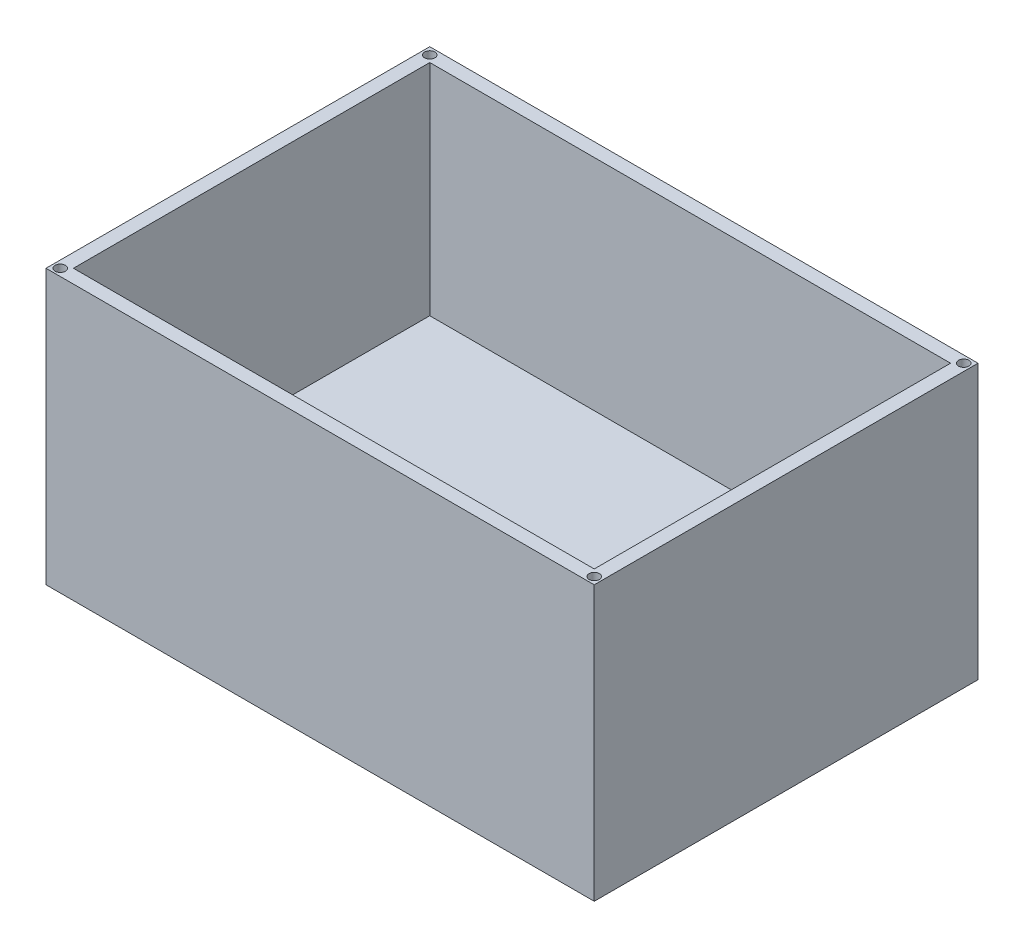
from build123d import *

# Parameters (mm, degrees)
SKETCH1_W                            = 254
SKETCH1_H                            = 177.8
BOSS_EXTRUDE1_DEPTH                  = 127
SKETCH2_W                            = 241.3
SKETCH2_H                            = 165.1
CUT_EXTRUDE1_DEPTH                   = 101.6
F_3_16_0_1875_DIAMETER_HOLE3_D       = 4.7625
F_3_16_0_1875_DIAMETER_HOLE3_DEPTH   = 12.7
F_3_16_0_1875_DIAMETER_HOLE3_TIP     = 1.430799349
F_3_16_0_1875_DIAMETER_HOLE4_D       = 4.7625
F_3_16_0_1875_DIAMETER_HOLE4_DEPTH   = 12.7
F_3_16_0_1875_DIAMETER_HOLE4_TIP     = 1.430799349
F_3_16_0_1875_DIAMETER_HOLE5_D       = 4.7625
F_3_16_0_1875_DIAMETER_HOLE5_DEPTH   = 12.7
F_3_16_0_1875_DIAMETER_HOLE5_TIP     = 1.430799349
F_3_16_0_1875_DIAMETER_HOLE6_D       = 4.7625
F_3_16_0_1875_DIAMETER_HOLE6_DEPTH   = 12.7
F_3_16_0_1875_DIAMETER_HOLE6_TIP     = 1.430799349
F_11_64_0_17188_DIAMETER_HOLE1_D     = 4.365752
F_11_64_0_17188_DIAMETER_HOLE1_DEPTH = 6.35


with BuildPart() as part:
    # Sketch1 → Boss-Extrude1 (new body)
    with BuildSketch(Plane(origin=(0, 0, 0), x_dir=(1, 0, 0), z_dir=(0, 1, 0))):
        Rectangle(SKETCH1_W, SKETCH1_H)
    extrude(amount=BOSS_EXTRUDE1_DEPTH)

    # Sketch2 → Cut-Extrude1 (cut)
    with BuildSketch(Plane(origin=(0, 127, 0), x_dir=(1, 0, 0), z_dir=(0, 1, 0))):
        Rectangle(SKETCH2_W, SKETCH2_H)
    extrude(amount=-CUT_EXTRUDE1_DEPTH, mode=Mode.SUBTRACT)

    # 3/16 (0.1875) Diameter Hole3
    with Locations(Plane(origin=(-123.698, 127, -85.598), x_dir=(0, 0, 1), z_dir=(0, 1, 0))):
        with Locations((0, 0)):
            Hole(F_3_16_0_1875_DIAMETER_HOLE3_D / 2, depth=F_3_16_0_1875_DIAMETER_HOLE3_DEPTH)
            with Locations((0, 0, -(F_3_16_0_1875_DIAMETER_HOLE3_DEPTH + F_3_16_0_1875_DIAMETER_HOLE3_TIP / 2))):  # 118° drill point
                Cone(0, F_3_16_0_1875_DIAMETER_HOLE3_D / 2, F_3_16_0_1875_DIAMETER_HOLE3_TIP, mode=Mode.SUBTRACT)

    # 3/16 (0.1875) Diameter Hole4
    with Locations(Plane(origin=(123.698, 127, -85.598), x_dir=(0, 0, 1), z_dir=(0, 1, 0))):
        with Locations((0, 0)):
            Hole(F_3_16_0_1875_DIAMETER_HOLE4_D / 2, depth=F_3_16_0_1875_DIAMETER_HOLE4_DEPTH)
            with Locations((0, 0, -(F_3_16_0_1875_DIAMETER_HOLE4_DEPTH + F_3_16_0_1875_DIAMETER_HOLE4_TIP / 2))):  # 118° drill point
                Cone(0, F_3_16_0_1875_DIAMETER_HOLE4_D / 2, F_3_16_0_1875_DIAMETER_HOLE4_TIP, mode=Mode.SUBTRACT)

    # 3/16 (0.1875) Diameter Hole5
    with Locations(Plane(origin=(-123.698, 127, 85.598), x_dir=(0, 0, 1), z_dir=(0, 1, 0))):
        with Locations((0, 0)):
            Hole(F_3_16_0_1875_DIAMETER_HOLE5_D / 2, depth=F_3_16_0_1875_DIAMETER_HOLE5_DEPTH)
            with Locations((0, 0, -(F_3_16_0_1875_DIAMETER_HOLE5_DEPTH + F_3_16_0_1875_DIAMETER_HOLE5_TIP / 2))):  # 118° drill point
                Cone(0, F_3_16_0_1875_DIAMETER_HOLE5_D / 2, F_3_16_0_1875_DIAMETER_HOLE5_TIP, mode=Mode.SUBTRACT)

    # 3/16 (0.1875) Diameter Hole6
    with Locations(Plane(origin=(123.698, 127, 85.598), x_dir=(0, 0, 1), z_dir=(0, 1, 0))):
        with Locations((0, 0)):
            Hole(F_3_16_0_1875_DIAMETER_HOLE6_D / 2, depth=F_3_16_0_1875_DIAMETER_HOLE6_DEPTH)
            with Locations((0, 0, -(F_3_16_0_1875_DIAMETER_HOLE6_DEPTH + F_3_16_0_1875_DIAMETER_HOLE6_TIP / 2))):  # 118° drill point
                Cone(0, F_3_16_0_1875_DIAMETER_HOLE6_D / 2, F_3_16_0_1875_DIAMETER_HOLE6_TIP, mode=Mode.SUBTRACT)

    # 11/64 (0.17188) Diameter Hole1
    with Locations(Plane.XY.offset(-82.55)):
        with Locations((90.000861875, 33.401943058), (90.000861875, 61.115793816), (77.507570052, 52.735678174), (77.507570052, 38.856201142), (103.356898088, 52.735678174), (103.356898088, 38.856201142), (90.000861875, 46.977884259)):
            Hole(F_11_64_0_17188_DIAMETER_HOLE1_D / 2, depth=F_11_64_0_17188_DIAMETER_HOLE1_DEPTH)


solid = part.part
